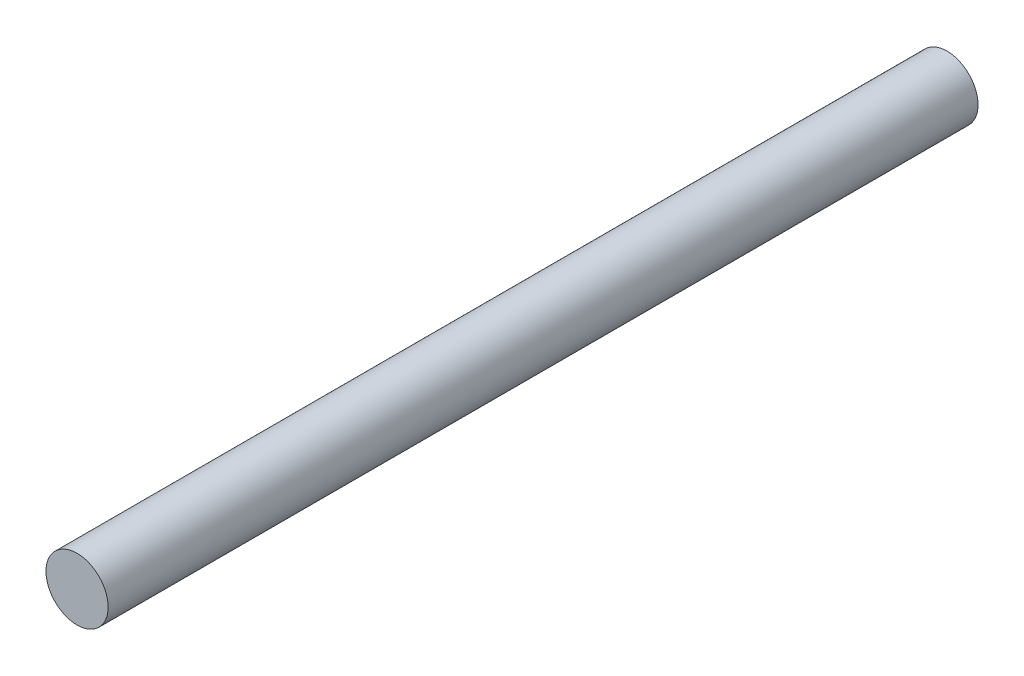
from build123d import *

# Parameters (mm, degrees)
SKETCH1_R           = 7.5
BOSS_EXTRUDE1_DEPTH = 210


with BuildPart() as part:
    # Sketch1 → Boss-Extrude1 (new body)
    with BuildSketch(Plane.XY):
        with Locations(Location((0, 0, 0), (0, 0, 180))):
            Circle(SKETCH1_R)
    extrude(amount=BOSS_EXTRUDE1_DEPTH)


solid = part.part
